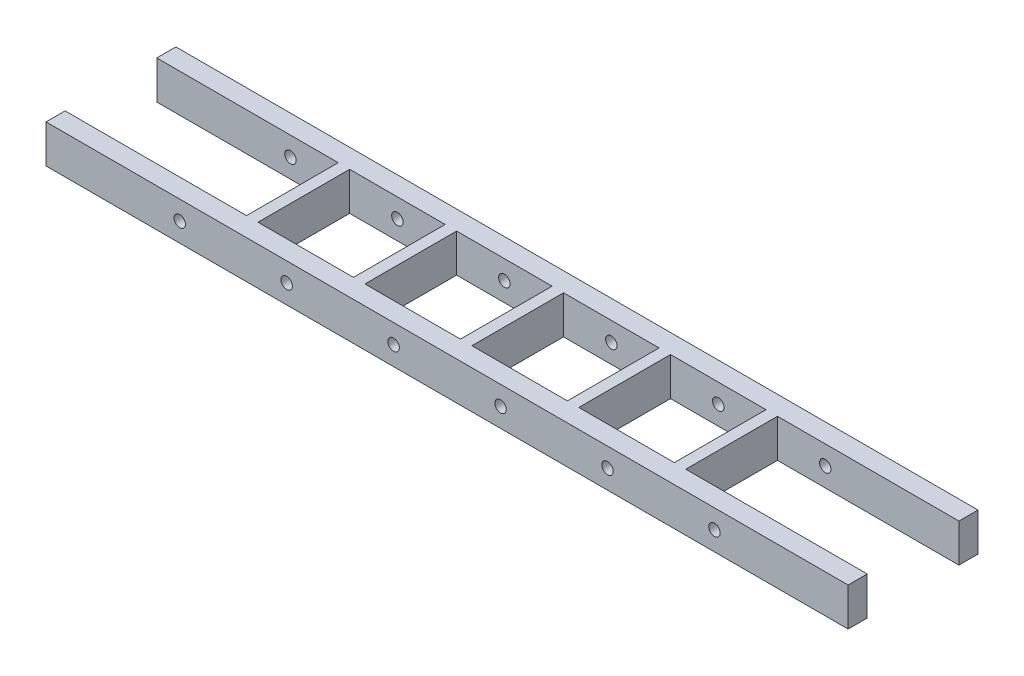
from build123d import *

# Parameters (mm, degrees)
SKETCH_1_W      = 210
SKETCH_1_H      = 10
SKETCH_1_R      = 1.5
EXTRUDE_1_DEPTH = 5
EXTRUDE_START   = 29
SKETCH_1_3_W    = 210
SKETCH_1_3_H    = 10
SKETCH_1_3_R    = 1.5
EXTRUDE_2_DEPTH = 5
SKETCH_1_4_W    = 3
SKETCH_1_4_H    = 10
EXTRUDE_3_DEPTH = 29


with BuildPart() as part:
    # 草图1 → 凸台-拉伸1 (new body)
    with BuildSketch(Plane.XY):
        Rectangle(SKETCH_1_W, SKETCH_1_H)
        with Locations((-70, 0)):
            Circle(SKETCH_1_R, mode=Mode.SUBTRACT)
        with Locations((-42, 0)):
            Circle(SKETCH_1_R, mode=Mode.SUBTRACT)
        with Locations((-14, 0)):
            Circle(SKETCH_1_R, mode=Mode.SUBTRACT)
        with Locations((14, 0)):
            Circle(SKETCH_1_R, mode=Mode.SUBTRACT)
        with Locations((42, 0)):
            Circle(SKETCH_1_R, mode=Mode.SUBTRACT)
        with Locations((70, 0)):
            Circle(SKETCH_1_R, mode=Mode.SUBTRACT)
    extrude(amount=EXTRUDE_1_DEPTH)



with BuildPart() as body_2:
    # 草图1<3> → 凸台-拉伸2 (new body)
    with BuildSketch(Plane.XY.offset(EXTRUDE_START)):
        Rectangle(SKETCH_1_3_W, SKETCH_1_3_H)
        with Locations((-70, 0)):
            Circle(SKETCH_1_3_R, mode=Mode.SUBTRACT)
        with Locations((-42, 0)):
            Circle(SKETCH_1_3_R, mode=Mode.SUBTRACT)
        with Locations((-14, 0)):
            Circle(SKETCH_1_3_R, mode=Mode.SUBTRACT)
        with Locations((14, 0)):
            Circle(SKETCH_1_3_R, mode=Mode.SUBTRACT)
        with Locations((42, 0)):
            Circle(SKETCH_1_3_R, mode=Mode.SUBTRACT)
        with Locations((70, 0)):
            Circle(SKETCH_1_3_R, mode=Mode.SUBTRACT)
    extrude(amount=EXTRUDE_2_DEPTH)


with BuildPart() as part_1:
    add(part.part)

    add(body_2.part)  # 凸台-拉伸3 merges body 2
    # 草图1<4> → 凸台-拉伸3 (add)
    with BuildSketch(Plane.XY):
        with Locations((-56, 0)):
            Rectangle(SKETCH_1_4_W, SKETCH_1_4_H)
        with Locations((-28, 0)):
            Rectangle(SKETCH_1_4_W, SKETCH_1_4_H)
        Rectangle(SKETCH_1_4_W, SKETCH_1_4_H)
        with Locations((28, 0)):
            Rectangle(SKETCH_1_4_W, SKETCH_1_4_H)
        with Locations((56, 0)):
            Rectangle(SKETCH_1_4_W, SKETCH_1_4_H)
    extrude(amount=EXTRUDE_3_DEPTH)


solid = part_1.part
